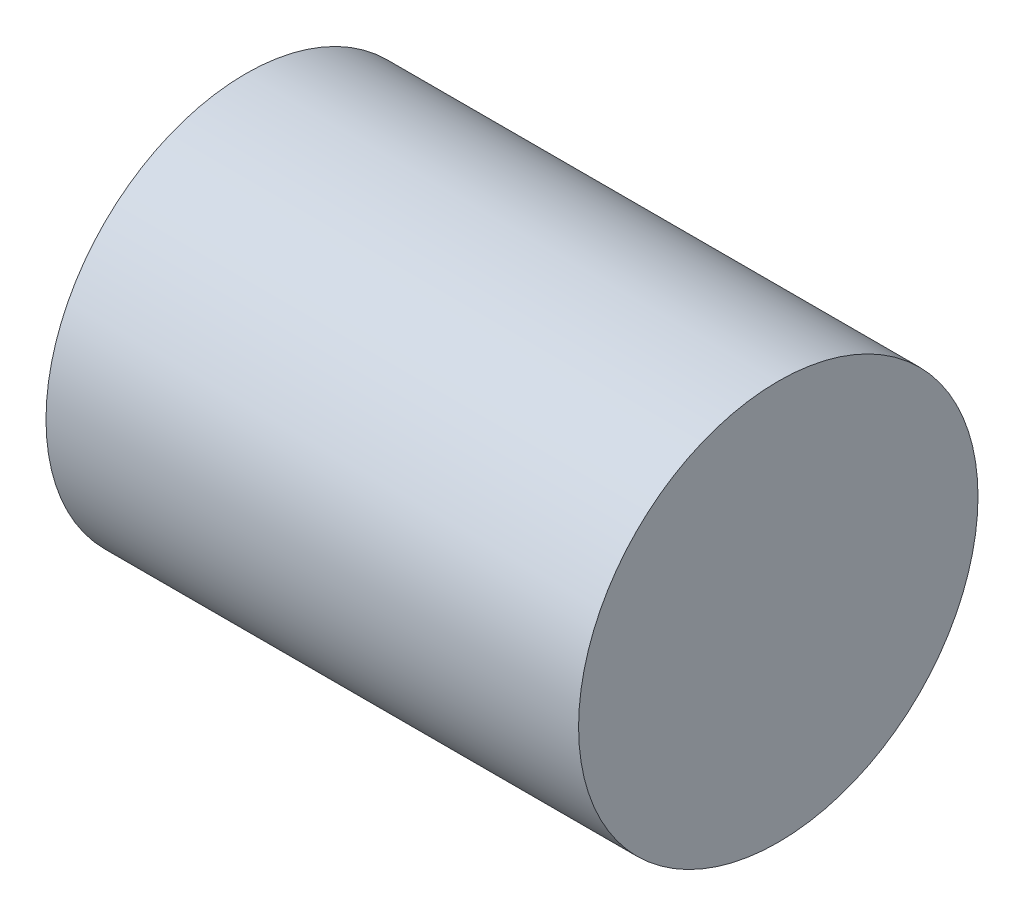
from build123d import *

# Parameters (mm, degrees)
BOSS_EXTRUDE1_DEPTH      = 100
BOSS_EXTRUDE1_DEPTH_BACK = 100
SKETCH1_R                = 75


with BuildPart() as part:
    # Sketch1 → Boss-Extrude1 (new, two sides: drawn at the far end of the back side and taken through both)
    with BuildSketch(Plane(origin=(0, 0, 0), x_dir=(0, 0, -1), z_dir=(1, 0, 0)).offset(-BOSS_EXTRUDE1_DEPTH_BACK)):
        Circle(SKETCH1_R)
    extrude(amount=BOSS_EXTRUDE1_DEPTH + BOSS_EXTRUDE1_DEPTH_BACK)


solid = part.part
